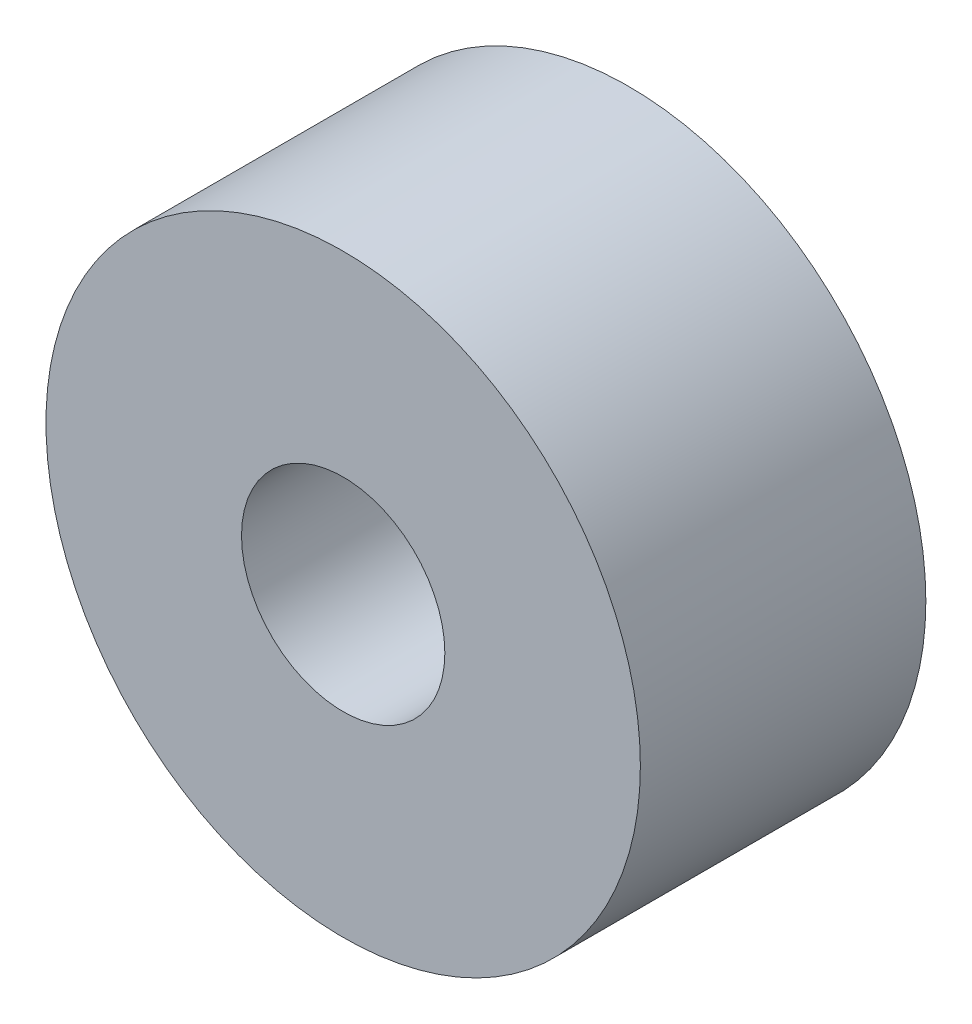
from build123d import *

# Parameters (mm, degrees)
SKETCH1_R           = 9.652
SKETCH1_R_2         = 3.302
BOSS_EXTRUDE1_DEPTH = 9.271


with BuildPart() as part:
    # Sketch1 → Boss-Extrude1 (new body)
    with BuildSketch(Plane.XY):
        Circle(SKETCH1_R)
        Circle(SKETCH1_R_2, mode=Mode.SUBTRACT)
    extrude(amount=BOSS_EXTRUDE1_DEPTH)


solid = part.part
